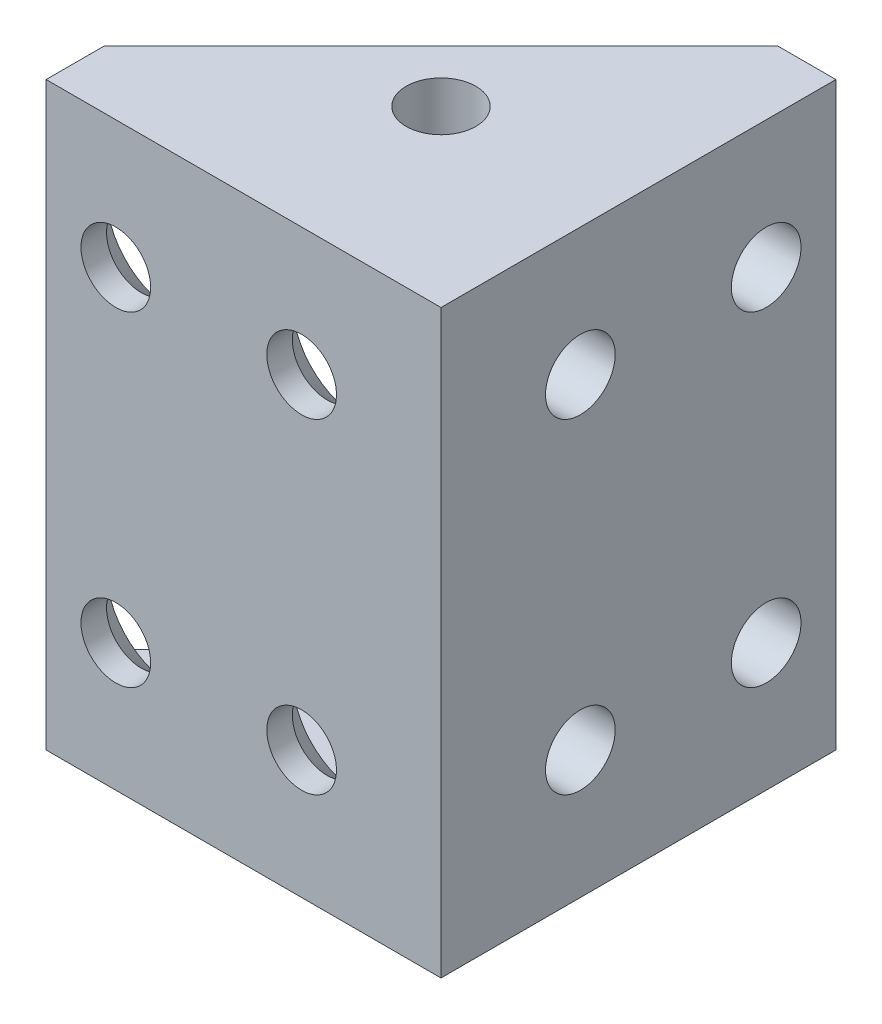
from build123d import *

# Parameters (mm, degrees)
EXTRUDE_1_DEPTH          = 25
EXTRUDE_3_DEPTH          = 2.5
EXTRUDE_4_DEPTH          = 2.5
SKETCH_8_R               = 1.5
CUT_EXTRUDE_1_DEPTH      = 31.124740663
SKETCH_9_R               = 1.5
CUT_EXTRUDE_2_DEPTH      = 33.913712948
SKETCH_10_R              = 1.5
CUT_EXTRUDE_3_DEPTH      = 31.745934691
HOLE_WIZARD_2_AT_2_COUNT = 2
HOLE_WIZARD_2_AT_2_PITCH = 8
HOLE_WIZARD_2_AT_3_COUNT = 2
HOLE_WIZARD_2_AT_3_PITCH = 16.124515497
HOLE_WIZARD_2_AT_4_COUNT = 2
HOLE_WIZARD_2_AT_4_PITCH = 14


with BuildPart() as part:
    # 草图1 → 凸台-拉伸1 (new body)
    with BuildSketch(Plane(origin=(0, 0, 0), x_dir=(1, 0, 0), z_dir=(0, 1, 0))):
        Polygon((6, 1.25), (6, 15.75), (8.5, 15.75), (8.5, 1.25), (8.5, -1.25), (-8.5, -1.25), (-8.5, 1.25), align=None)
    extrude(amount=EXTRUDE_1_DEPTH)

    # 草图5 → 凸台-拉伸3 (add)
    with BuildSketch(Plane.XZ):
        Polygon((6, -15.75), (6, -1.25), (-8.5, -1.25), align=None)
    extrude(amount=-EXTRUDE_3_DEPTH)

    # 草图6 → 凸台-拉伸4 (add)
    with BuildSketch(Plane(origin=(0, 25, 0), x_dir=(1, 0, 0), z_dir=(0, 1, 0))):
        Polygon((6, 15.75), (6, 1.25), (-8.5, 1.25), align=None)
    extrude(amount=-EXTRUDE_4_DEPTH)

    # 草图8 → 切除-拉伸1 (cut, through all)
    with BuildSketch(Plane(origin=(0, 0, -1.25), x_dir=(-1, 0, 0), z_dir=(0, 0, -1))):
        with Locations((-2.5, 19.5)):
            Circle(SKETCH_8_R)
        with Locations((5.5, 19.5)):
            Circle(SKETCH_8_R)
        with Locations((5.5, 5.5)):
            Circle(SKETCH_8_R)
        with Locations((-2.5, 5.5)):
            Circle(SKETCH_8_R)
    extrude(amount=-CUT_EXTRUDE_1_DEPTH, mode=Mode.SUBTRACT)

    # 草图9 → 切除-拉伸2 (cut, through all)
    with BuildSketch(Plane.ZY.offset(-6)):
        with Locations((-12.75, 19.5)):
            Circle(SKETCH_9_R)
        with Locations((-12.75, 5.5)):
            Circle(SKETCH_9_R)
        with Locations((-4.75, 19.5)):
            Circle(SKETCH_9_R)
        with Locations((-4.75, 5.5)):
            Circle(SKETCH_9_R)
    extrude(amount=-CUT_EXTRUDE_2_DEPTH, mode=Mode.SUBTRACT)

    # 草图10 → 切除-拉伸3 (cut, through all)
    with BuildSketch(Plane.XZ):
        with Locations(Location((1, -6.25, 0), (0, 0, 270))):
            Circle(SKETCH_10_R)
    extrude(amount=-CUT_EXTRUDE_3_DEPTH, mode=Mode.SUBTRACT)

    # 草图14 → 打孔尺寸(%根据十字)槽沉头木螺钉的类型2 (revolve, cut)
    with BuildSketch(Plane(origin=(-5.5, 5.5, -1.25), x_dir=(0, 1, 0), z_dir=(1, 0, 0))):
        Polygon((0, 0), (0, 2.5), (1.5, 2.5), (1.5, 1.4), (2.9, 0), align=None)
    hole_wizard_2 = revolve(axis=Axis((-5.5, 5.5, -7.6), (0, 0, 1)), mode=Mode.SUBTRACT)

    # 打孔尺寸(%根据十字)槽沉头木螺钉的类型2 at 2: 打孔尺寸(%根据十字)槽沉头木螺钉的类型2 ×2
    with Locations(*[(i * HOLE_WIZARD_2_AT_2_PITCH, 0, 0) for i in range(1, HOLE_WIZARD_2_AT_2_COUNT)]):
        add(hole_wizard_2, mode=Mode.SUBTRACT)

    # 打孔尺寸(%根据十字)槽沉头木螺钉的类型2 at 3: 打孔尺寸(%根据十字)槽沉头木螺钉的类型2 ×2
    with Locations(*[Vector(0.49613893835683387, 0.8682431421244591, 0) * (i * HOLE_WIZARD_2_AT_3_PITCH) for i in range(1, HOLE_WIZARD_2_AT_3_COUNT)]):
        add(hole_wizard_2, mode=Mode.SUBTRACT)

    # 打孔尺寸(%根据十字)槽沉头木螺钉的类型2 at 4: 打孔尺寸(%根据十字)槽沉头木螺钉的类型2 ×2
    with Locations(*[(0, i * HOLE_WIZARD_2_AT_4_PITCH, 0) for i in range(1, HOLE_WIZARD_2_AT_4_COUNT)]):
        add(hole_wizard_2, mode=Mode.SUBTRACT)


solid = part.part
